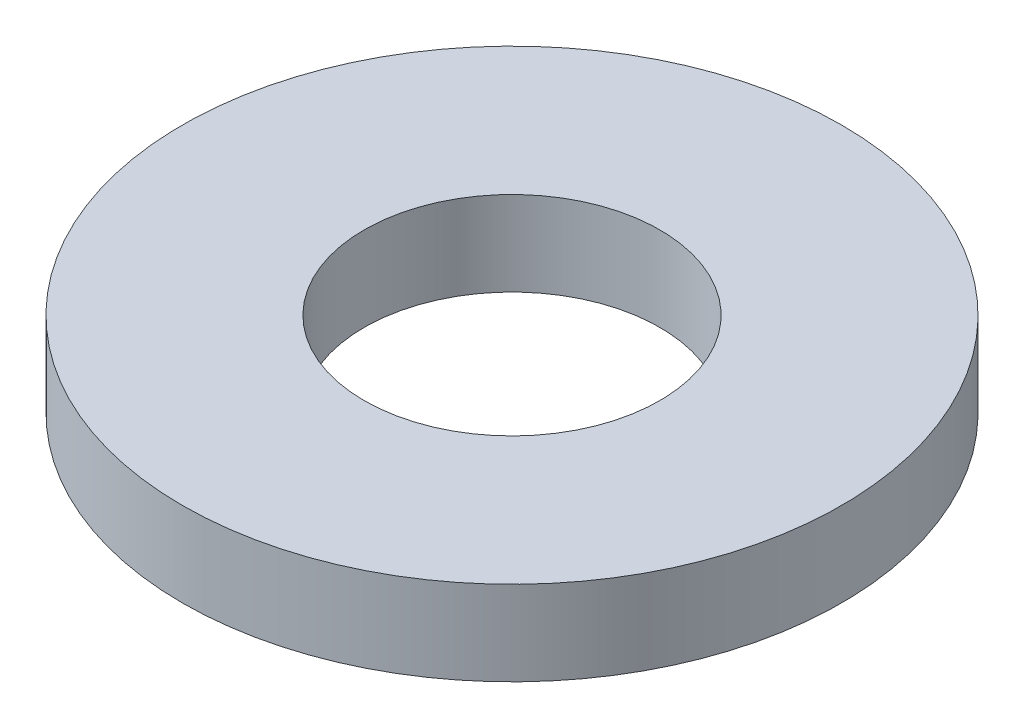
from build123d import *

# Parameters (mm, degrees)
SKETCH1_R           = 3.9624
BOSS_EXTRUDE1_DEPTH = 1.016
SKETCH5_R           = 1.778
CUT_EXTRUDE1_DEPTH  = 6.695040256


with BuildPart() as part:
    # Sketch1 → Boss-Extrude1 (new body)
    with BuildSketch(Plane(origin=(0, 0, 0), x_dir=(1, 0, 0), z_dir=(0, 1, 0))):
        with Locations(Location((0, 0, 0), (0, 0, 270))):
            Circle(SKETCH1_R)
    extrude(amount=BOSS_EXTRUDE1_DEPTH)

    # Sketch5 → Cut-Extrude1 (cut, through all)
    with BuildSketch(Plane(origin=(0, 1.016, 0), x_dir=(-1, 0, 0), z_dir=(0, 1, 0))):
        with Locations(Location((0, 0, 0), (0, 0, 90))):
            Circle(SKETCH5_R)
    extrude(amount=-CUT_EXTRUDE1_DEPTH, mode=Mode.SUBTRACT)


solid = part.part
